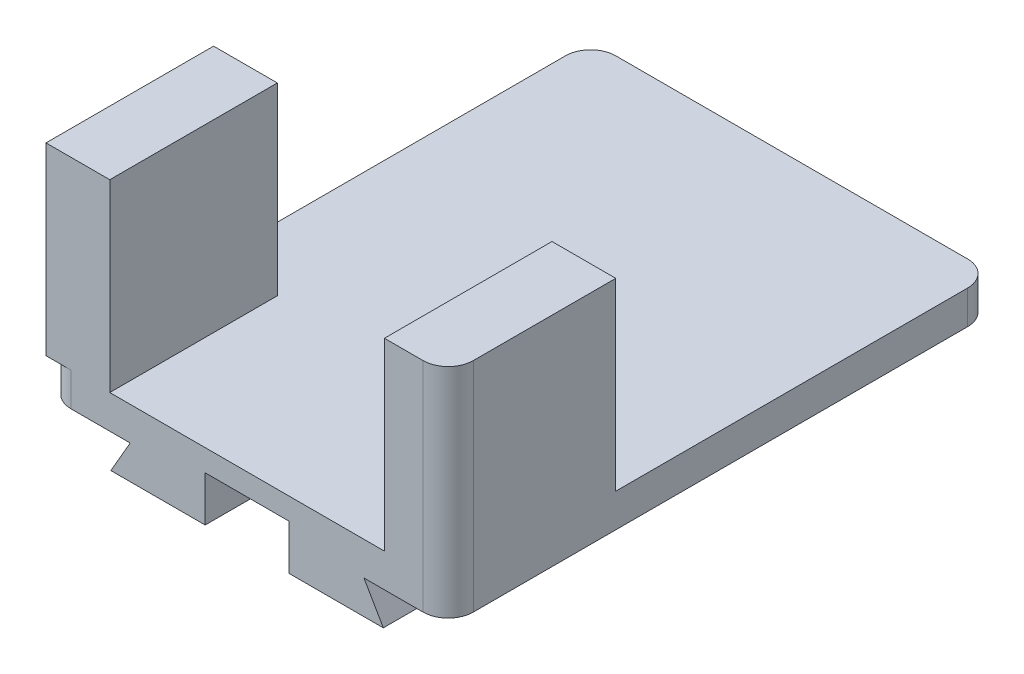
from build123d import *

# Parameters (mm, degrees)
EXTRUDE1_DEPTH = 82.55
SKETCH8_W      = 9.6647
SKETCH8_H      = 25.4
EXTRUDE6_DEPTH = 27.94
FILLET1_R      = 3.81


with BuildPart() as part:
    # Sketch1 → Extrude1 (new body)
    with BuildSketch(Plane.XY):
        Polygon((0, 0), (30.48, 0), (30.48, -5.08), (17.717260633, -5.08), (20.6502, -10.16), (6.35, -10.16), (6.35, -3.302), (-6.35, -3.302), (-6.35, -10.16), (-20.6502, -10.16), (-17.717260633, -5.08), (-30.48, -5.08), (-30.48, 0), align=None)
    extrude(amount=EXTRUDE1_DEPTH)

    # Sketch8 → Extrude6 (add)
    with BuildSketch(Plane(origin=(0, 0, 0), x_dir=(1, 0, 0), z_dir=(0, 1, 0))):
        with Locations((25.64765, -69.85)):
            Rectangle(SKETCH8_W, SKETCH8_H)
    extrude6 = extrude(amount=EXTRUDE6_DEPTH)

    # Fillet1
    fillet1_edges = [part.edges().sort_by_distance(p)[0] for p in [
        (30.48, -2.54, 0),
        (-30.48, -2.54, 0),
        (30.48, 11.43, 82.55),
        (-30.48, -2.54, 82.55),
    ]]
    fillet(fillet1_edges, radius=FILLET1_R)

    # Mirror1: Extrude6 across plane
    add(extrude6.mirror(Plane(origin=(0, 0, 0), x_dir=(0, 0, 1), z_dir=(1, 0, 0))))


solid = part.part
